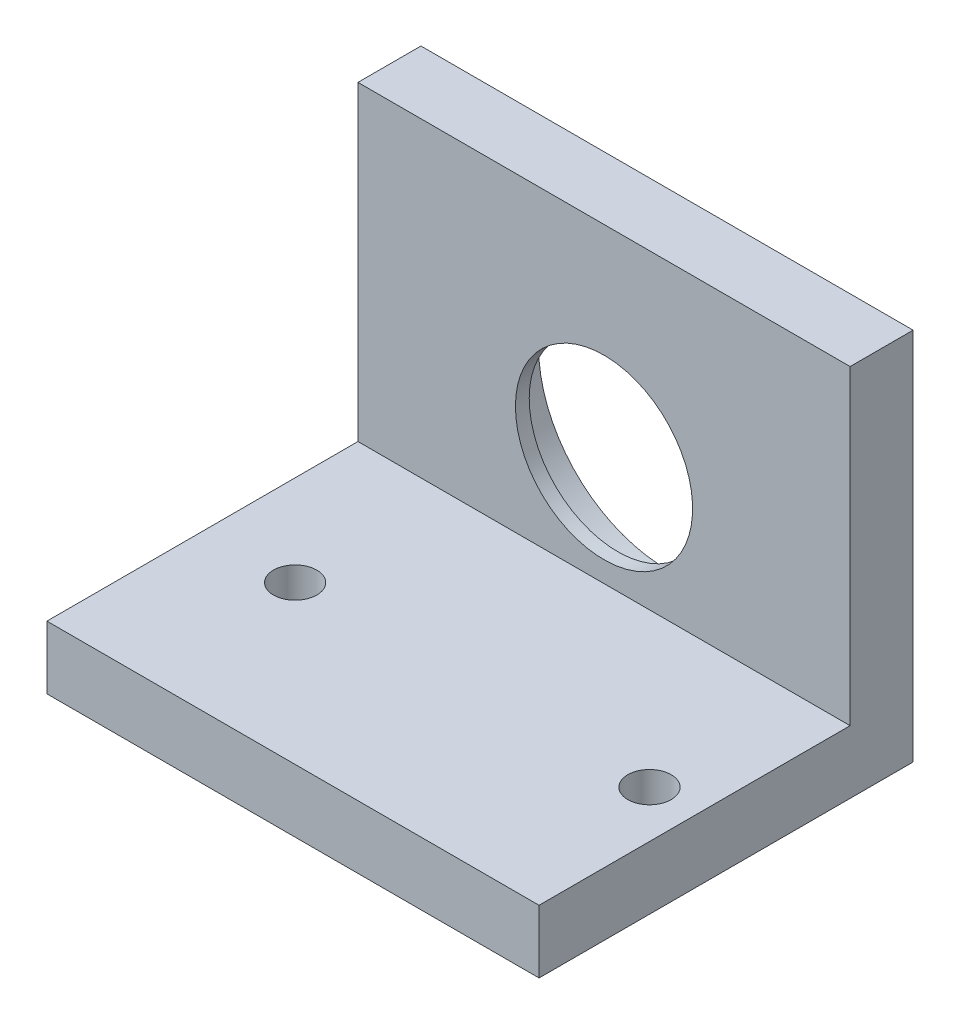
from build123d import *

# Parameters (mm, degrees)
BOSS_EXTRUDE1_DEPTH = 50
SKETCH3_R           = 9
CUT_EXTRUDE1_DEPTH  = 50
SKETCH4_R           = 13.05
CUT_EXTRUDE2_DEPTH  = 5
SKETCH6_R           = 2.2
CUT_EXTRUDE3_DEPTH  = 8


with BuildPart() as part:
    # Sketch1 → Boss-Extrude1 (new body)
    with BuildSketch(Plane(origin=(0, 0, 0), x_dir=(0, 0, -1), z_dir=(1, 0, 0))):
        Polygon((0, 0), (38, 0), (38, 38), (31.6, 38), (31.6, 6.4), (0, 6.4), align=None)
    extrude(amount=BOSS_EXTRUDE1_DEPTH)

    # Sketch3 → Cut-Extrude1 (cut)
    with BuildSketch(Plane(origin=(0, 0, -38), x_dir=(-1, 0, 0), z_dir=(0, 0, -1))):
        with Locations((-25, 17.5)):
            Circle(SKETCH3_R)
    extrude(amount=-CUT_EXTRUDE1_DEPTH, mode=Mode.SUBTRACT)

    # Sketch4 → Cut-Extrude2 (cut)
    with BuildSketch(Plane(origin=(0, 0, -38), x_dir=(-1, 0, 0), z_dir=(0, 0, -1))):
        with Locations((-25, 17.5)):
            Circle(SKETCH4_R)
    extrude(amount=-CUT_EXTRUDE2_DEPTH, mode=Mode.SUBTRACT)

    # Sketch6 → Cut-Extrude3 (cut)
    with BuildSketch(Plane(origin=(0, 6.4, 0), x_dir=(1, 0, 0), z_dir=(0, 1, 0))):
        with Locations(Location((9.217627347, 16, 0), (0, 0, 270))):
            Circle(SKETCH6_R)
        with Locations(Location((45.217627347, 16, 0), (0, 0, 270))):
            Circle(SKETCH6_R)
    extrude(amount=-CUT_EXTRUDE3_DEPTH, mode=Mode.SUBTRACT)


solid = part.part
